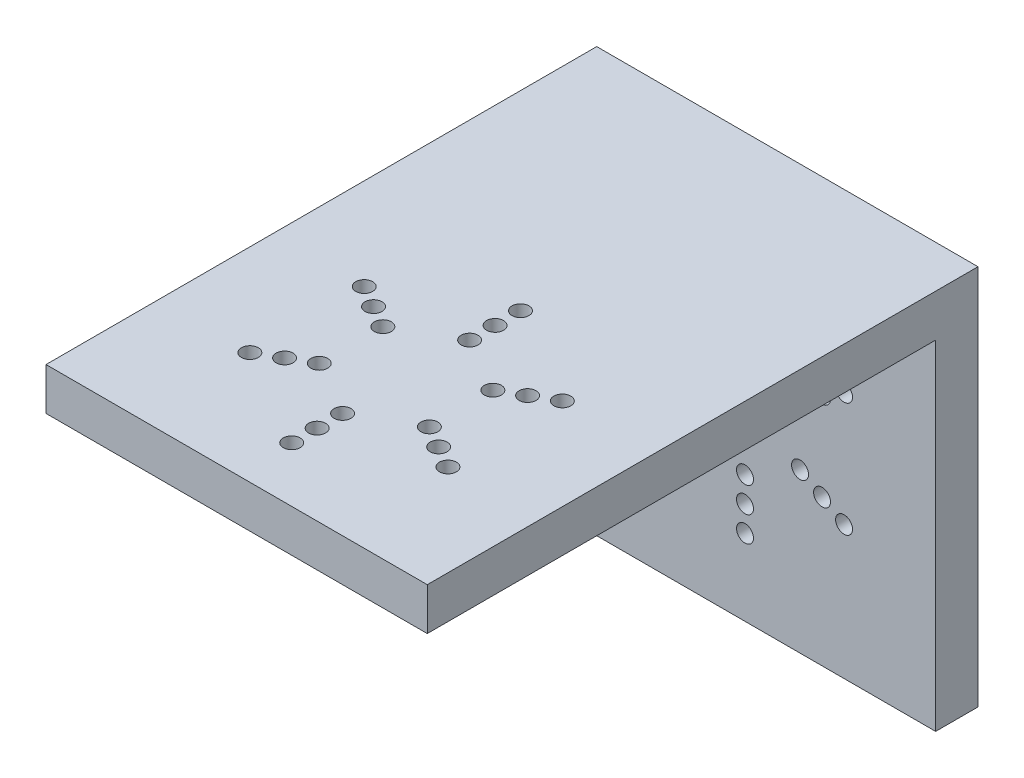
from build123d import *

# Parameters (mm, degrees)
SKETCH1_W           = 45
SKETCH1_H           = 45
SKETCH1_R           = 1
BOSS_EXTRUDE1_DEPTH = 5
SKETCH2_W           = 45
SKETCH2_H           = 5
BOSS_EXTRUDE2_DEPTH = 60
SKETCH3_R           = 1
CUT_EXTRUDE1_DEPTH  = 5


with BuildPart() as part:
    # Sketch1 → Boss-Extrude1 (new body)
    with BuildSketch(Plane.XY):
        Rectangle(SKETCH1_W, SKETCH1_H)
        with Locations((0, -13.5)):
            Circle(SKETCH1_R, mode=Mode.SUBTRACT)
        with Locations((0, -10.5)):
            Circle(SKETCH1_R, mode=Mode.SUBTRACT)
        with Locations((0, -7.5)):
            Circle(SKETCH1_R, mode=Mode.SUBTRACT)
        with Locations((-11.691342951, -6.75)):
            Circle(SKETCH1_R, mode=Mode.SUBTRACT)
        with Locations((-9.09326674, -5.25)):
            Circle(SKETCH1_R, mode=Mode.SUBTRACT)
        with Locations((-6.495190528, -3.75)):
            Circle(SKETCH1_R, mode=Mode.SUBTRACT)
        with Locations((-11.691342951, 6.75)):
            Circle(SKETCH1_R, mode=Mode.SUBTRACT)
        with Locations((-9.09326674, 5.25)):
            Circle(SKETCH1_R, mode=Mode.SUBTRACT)
        with Locations((-6.495190528, 3.75)):
            Circle(SKETCH1_R, mode=Mode.SUBTRACT)
        with Locations((0, 13.5)):
            Circle(SKETCH1_R, mode=Mode.SUBTRACT)
        with Locations((0, 10.5)):
            Circle(SKETCH1_R, mode=Mode.SUBTRACT)
        with Locations((0, 7.5)):
            Circle(SKETCH1_R, mode=Mode.SUBTRACT)
        with Locations((11.691342951, 6.75)):
            Circle(SKETCH1_R, mode=Mode.SUBTRACT)
        with Locations((9.09326674, 5.25)):
            Circle(SKETCH1_R, mode=Mode.SUBTRACT)
        with Locations((6.495190528, 3.75)):
            Circle(SKETCH1_R, mode=Mode.SUBTRACT)
        with Locations((11.691342951, -6.75)):
            Circle(SKETCH1_R, mode=Mode.SUBTRACT)
        with Locations((9.09326674, -5.25)):
            Circle(SKETCH1_R, mode=Mode.SUBTRACT)
        with Locations((6.495190528, -3.75)):
            Circle(SKETCH1_R, mode=Mode.SUBTRACT)
    extrude(amount=BOSS_EXTRUDE1_DEPTH)

    # Sketch2 → Boss-Extrude2 (add)
    with BuildSketch(Plane.XY.offset(5)):
        with Locations((0, 20)):
            Rectangle(SKETCH2_W, SKETCH2_H)
    extrude(amount=BOSS_EXTRUDE2_DEPTH)

    # Sketch3 → Cut-Extrude1 (cut)
    with BuildSketch(Plane(origin=(-5, 17.5, 0), x_dir=(0, 0, -1), z_dir=(0, 1, 0))):
        with Locations((-58.5, -5)):
            Circle(SKETCH3_R)
        with Locations((-55.5, -5)):
            Circle(SKETCH3_R)
        with Locations((-52.5, -5)):
            Circle(SKETCH3_R)
        with Locations((-51.75, 6.691342951)):
            Circle(SKETCH3_R)
        with Locations((-50.25, 4.09326674)):
            Circle(SKETCH3_R)
        with Locations((-48.75, 1.495190528)):
            Circle(SKETCH3_R)
        with Locations((-38.25, 6.691342951)):
            Circle(SKETCH3_R)
        with Locations((-39.75, 4.09326674)):
            Circle(SKETCH3_R)
        with Locations((-41.25, 1.495190528)):
            Circle(SKETCH3_R)
        with Locations((-31.5, -5)):
            Circle(SKETCH3_R)
        with Locations((-34.5, -5)):
            Circle(SKETCH3_R)
        with Locations((-37.5, -5)):
            Circle(SKETCH3_R)
        with Locations((-38.25, -16.691342951)):
            Circle(SKETCH3_R)
        with Locations((-39.75, -14.09326674)):
            Circle(SKETCH3_R)
        with Locations((-41.25, -11.495190528)):
            Circle(SKETCH3_R)
        with Locations((-51.75, -16.691342951)):
            Circle(SKETCH3_R)
        with Locations((-50.25, -14.09326674)):
            Circle(SKETCH3_R)
        with Locations((-48.75, -11.495190528)):
            Circle(SKETCH3_R)
    extrude(amount=CUT_EXTRUDE1_DEPTH, mode=Mode.SUBTRACT)


solid = part.part
